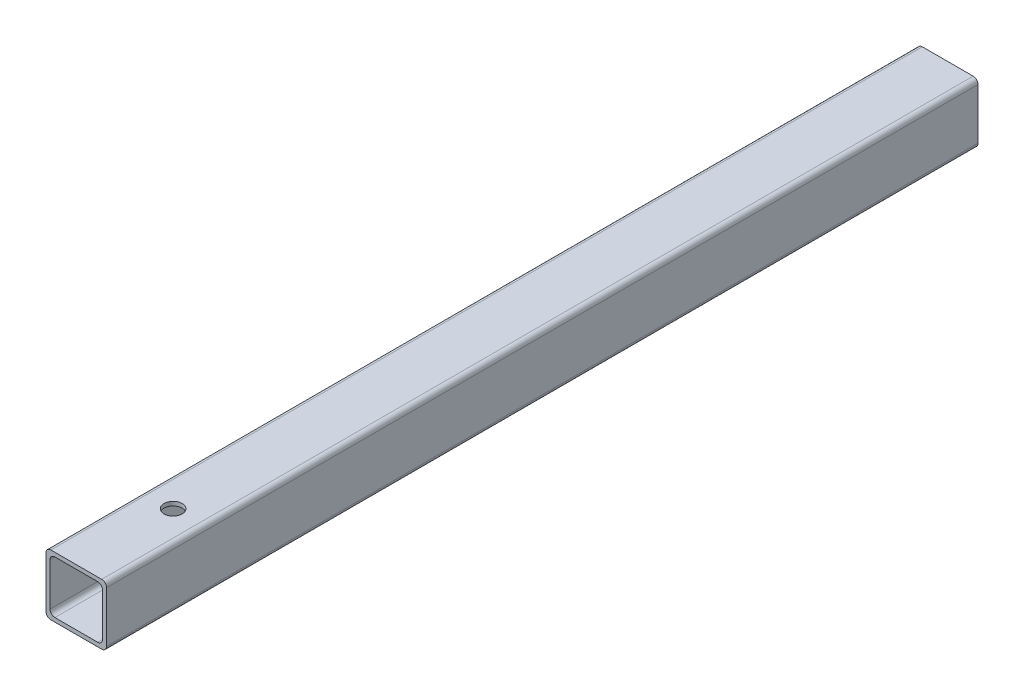
from build123d import *

# Parameters (mm, degrees)
SKETCH1_W           = 31.75
SKETCH1_H           = 31.75
SKETCH1_W_2         = 27.5336
SKETCH1_H_2         = 27.5336
BOSS_EXTRUDE1_DEPTH = 457.2
FILLET1_R           = 2.54
SKETCH2_R           = 4.7625
CUT_EXTRUDE1_DEPTH  = 459.575967671


with BuildPart() as part:
    # Sketch1 → Boss-Extrude1 (new body)
    with BuildSketch(Plane.XY):
        Rectangle(SKETCH1_W, SKETCH1_H)
        Rectangle(SKETCH1_W_2, SKETCH1_H_2, mode=Mode.SUBTRACT)
    extrude(amount=BOSS_EXTRUDE1_DEPTH)

    # Fillet1
    fillet1_edges = [part.edges().sort_by_distance(p)[0] for p in [
        (15.875, -15.875, 228.6),
        (13.7668, -13.7668, 228.6),
        (13.7668, 13.7668, 228.6),
        (15.875, 15.875, 228.6),
        (-13.7668, 13.7668, 228.6),
        (-15.875, 15.875, 228.6),
        (-13.7668, -13.7668, 228.6),
        (-15.875, -15.875, 228.6),
    ]]
    fillet(fillet1_edges, radius=FILLET1_R)

    # Sketch2 → Cut-Extrude1 (cut, through all)
    with BuildSketch(Plane(origin=(0, 15.875, 0), x_dir=(1, 0, 0), z_dir=(0, 1, 0))):
        with Locations((0, -406.4)):
            Circle(SKETCH2_R)
    extrude(amount=-CUT_EXTRUDE1_DEPTH, mode=Mode.SUBTRACT)


solid = part.part
